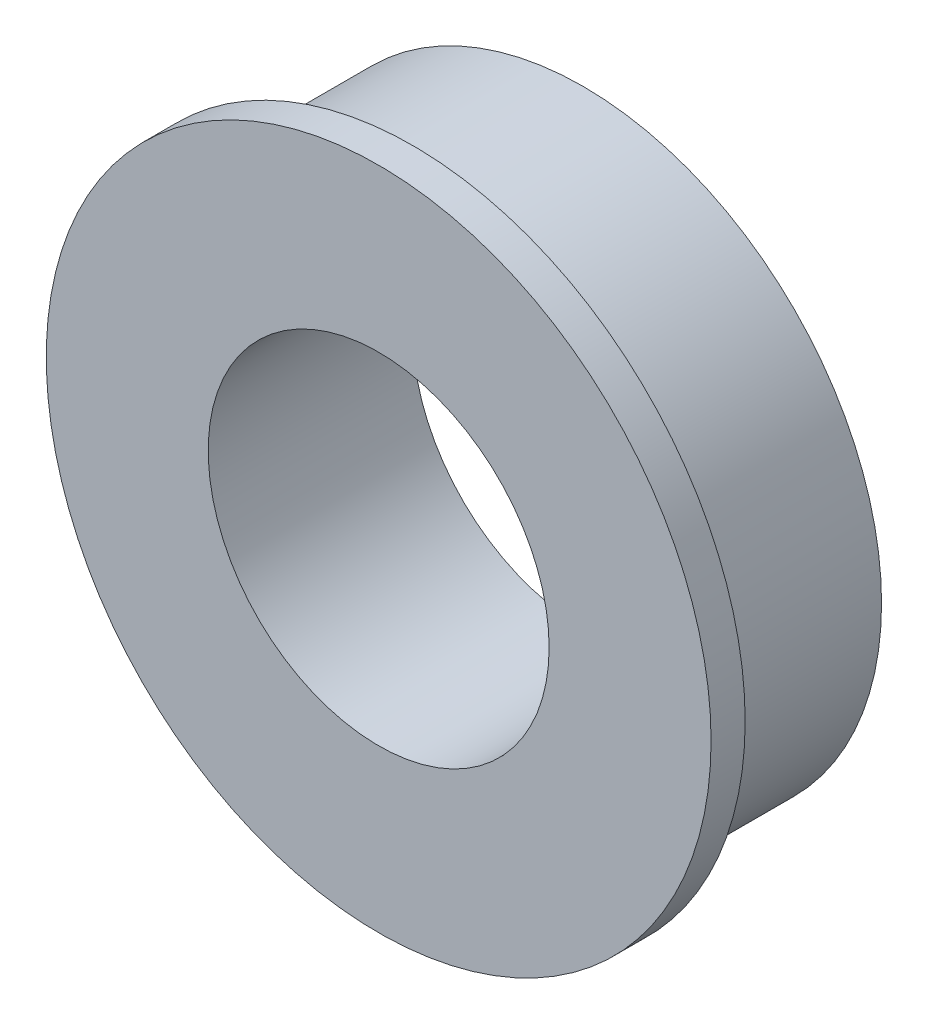
from build123d import *

# Parameters (mm, degrees)
SKETCH_1_R      = 7
SKETCH_1_R_2    = 4
EXTRUDE_1_DEPTH = 4
SKETCH_2_R      = 7.8
SKETCH_2_R_2    = 4
EXTRUDE_2_DEPTH = 0.8


with BuildPart() as part:
    # 草图1 → 凸台-拉伸1 (new body)
    with BuildSketch(Plane.XY):
        Circle(SKETCH_1_R)
        Circle(SKETCH_1_R_2, mode=Mode.SUBTRACT)
    extrude(amount=EXTRUDE_1_DEPTH)

    # 草图2 → 凸台-拉伸2 (add)
    with BuildSketch(Plane.XY.offset(4)):
        Circle(SKETCH_2_R)
        Circle(SKETCH_2_R_2, mode=Mode.SUBTRACT)
    extrude(amount=EXTRUDE_2_DEPTH)


solid = part.part
